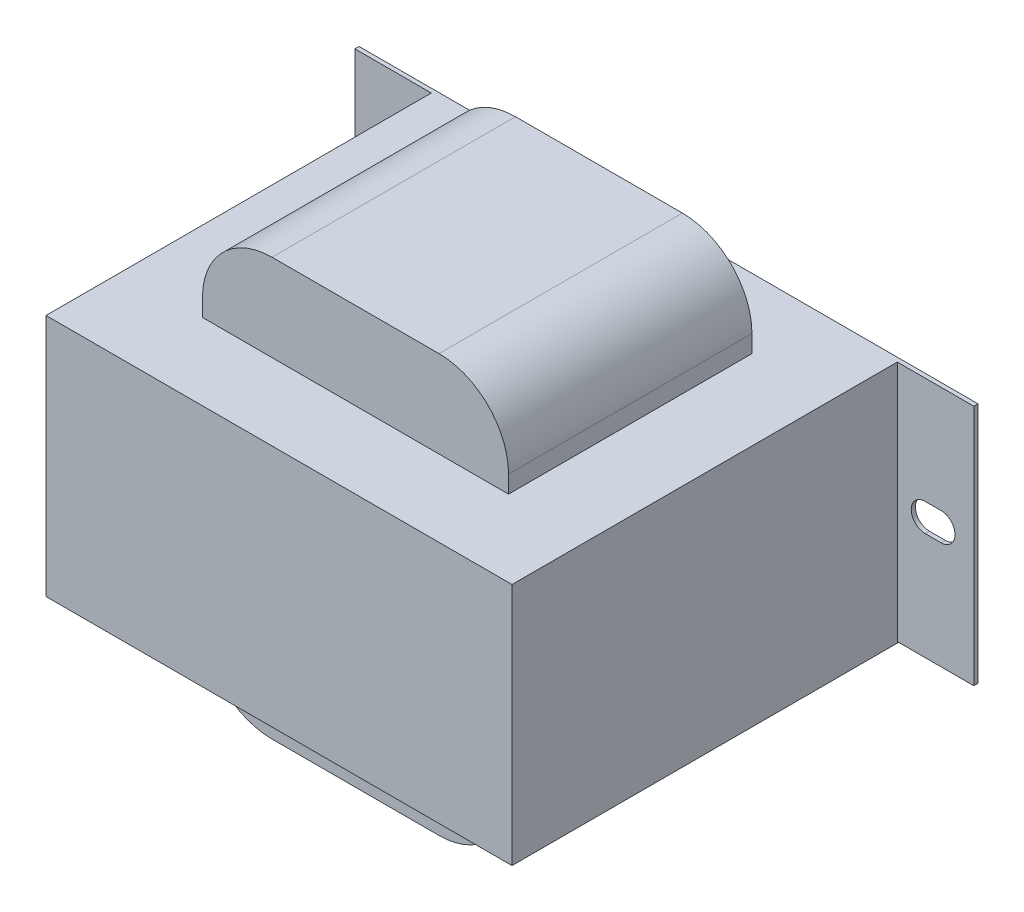
from build123d import *

# Parameters (mm, degrees)
SKETCH_1_W      = 67
SKETCH_1_H      = 35
EXTRUDE_1_DEPTH = 56
EXTRUDE_START   = -11
EXTRUDE_2_DEPTH = 35
SKETCH_3_W      = 11
SKETCH_3_H      = 34.80832271
EXTRUDE_3_DEPTH = 0.6


with BuildPart() as part:
    # 草图1 → 拉伸1 (new body)
    with BuildSketch(Plane.XY):
        Rectangle(SKETCH_1_W, SKETCH_1_H)
    extrude(amount=EXTRUDE_1_DEPTH)

    # 草图2 → 拉伸2 (add)
    with BuildSketch(Plane.XY.offset(56).offset(EXTRUDE_START)):
        with BuildLine():
            Line((-12, 30), (12, 30))
            ThreePointArc((12, 30), (19.071067812, 27.071067812), (22, 20))
            Line((22, 20), (22, -20))
            ThreePointArc((22, -20), (19.071067812, -27.071067812), (12, -30))
            Line((12, -30), (-12, -30))
            ThreePointArc((-12, -30), (-19.071067812, -27.071067812), (-22, -20))
            Line((-22, -20), (-22, 20))
            ThreePointArc((-22, 20), (-19.071067812, 27.071067812), (-12, 30))
        make_face()
    extrude(amount=-EXTRUDE_2_DEPTH)

    # 草图3 → 拉伸3 (add)
    # profile 1 of 2: a face of its own
    with BuildSketch(Plane(origin=(0, 0, 0), x_dir=(-1, 0, 0), z_dir=(0, 0, -1))):
        with Locations((-39, 0.095838645)):
            Rectangle(SKETCH_3_W, SKETCH_3_H)
        with BuildLine():
            Line((-39.8, 2.147245992), (-37.5, 2.147245992))
            ThreePointArc((-37.5, 2.147245992), (-35.5, 0.147245992), (-37.5, -1.852754008))
            Line((-37.5, -1.852754008), (-39.8, -1.852754008))
            ThreePointArc((-39.8, -1.852754008), (-41.8, 0.147245992), (-39.8, 2.147245992))
        make_face(mode=Mode.SUBTRACT)
    # profile 2 of 2: a face of its own
    with BuildSketch(Plane(origin=(0, 0, 0), x_dir=(-1, 0, 0), z_dir=(0, 0, -1))):
        with Locations((39, 0.095838645)):
            Rectangle(SKETCH_3_W, SKETCH_3_H)
        with BuildLine():
            Line((37.5, -1.852754008), (39.8, -1.852754008))
            ThreePointArc((39.8, -1.852754008), (41.8, 0.147245992), (39.8, 2.147245992))
            Line((39.8, 2.147245992), (37.5, 2.147245992))
            ThreePointArc((37.5, 2.147245992), (35.5, 0.147245992), (37.5, -1.852754008))
        make_face(mode=Mode.SUBTRACT)
    extrude(amount=-EXTRUDE_3_DEPTH)


solid = part.part
